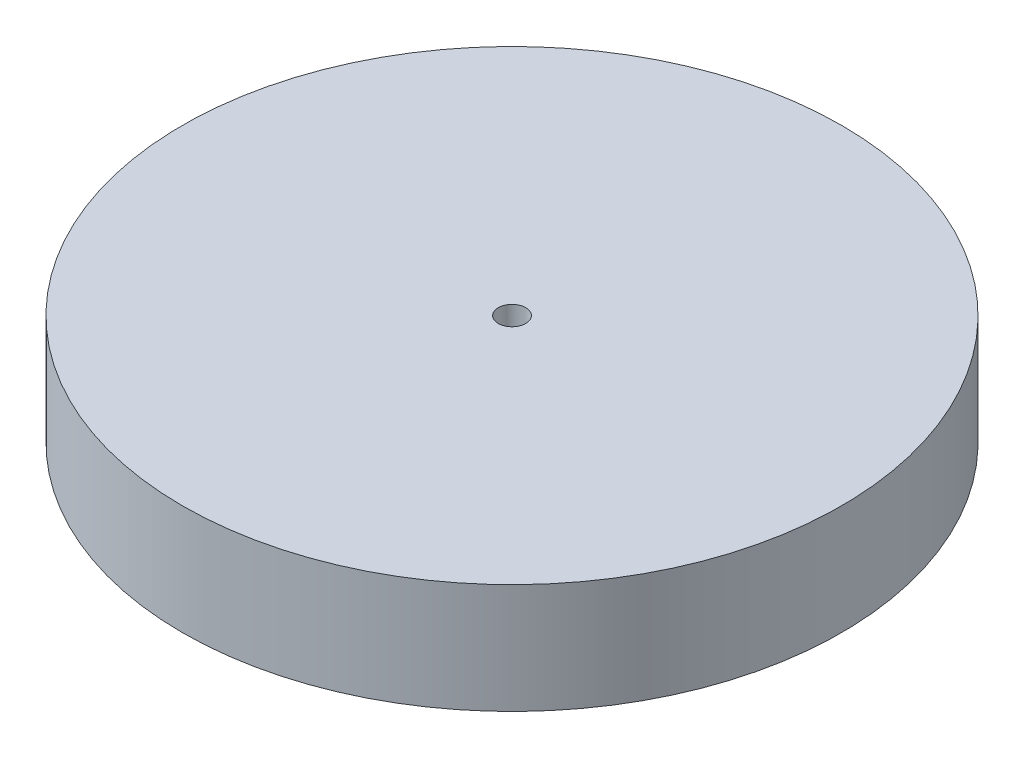
from build123d import *

# Parameters (mm, degrees)
SKETCH1_R           = 152.4
SKETCH1_R_2         = 6.35
BOSS_EXTRUDE1_DEPTH = 50.8


with BuildPart() as part:
    # Sketch1 → Boss-Extrude1 (new body)
    with BuildSketch(Plane(origin=(0, 0, 0), x_dir=(1, 0, 0), z_dir=(0, 1, 0))):
        with Locations(Location((0, 0, 0), (0, 0, 270))):
            Circle(SKETCH1_R)
        with Locations(Location((0, 0, 0), (0, 0, 270))):
            Circle(SKETCH1_R_2, mode=Mode.SUBTRACT)
    extrude(amount=BOSS_EXTRUDE1_DEPTH)


solid = part.part
